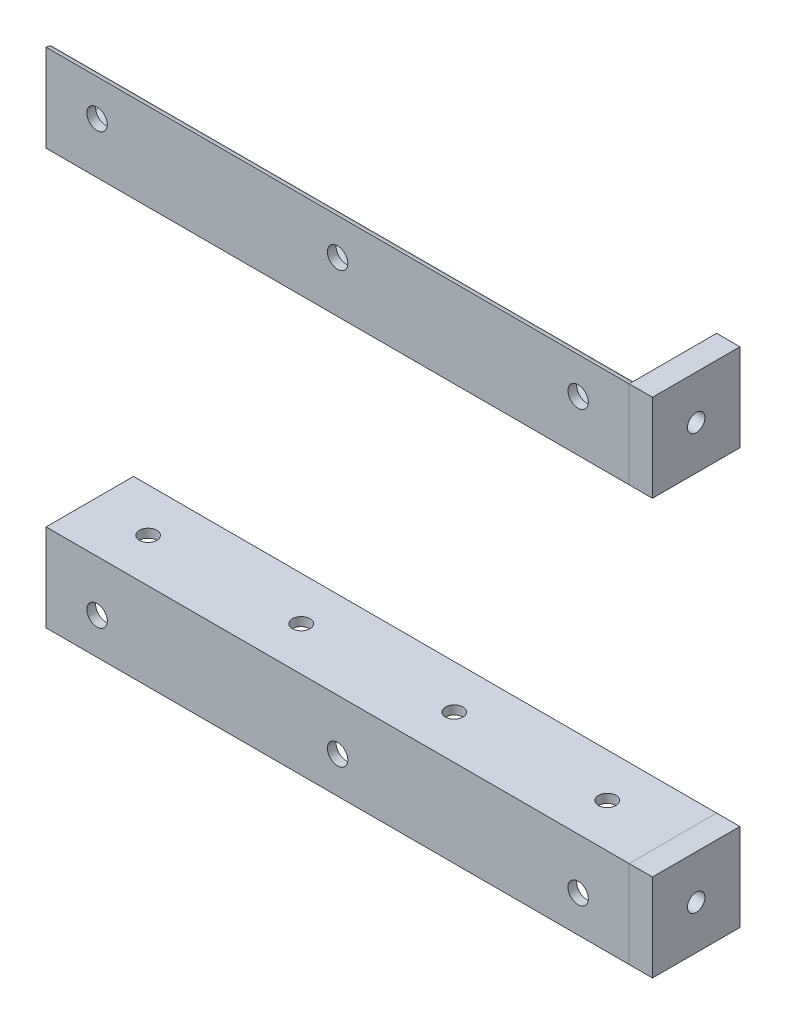
from build123d import *

# Parameters (mm, degrees)
GBT_706_2008_60_60_6_1_DEPTH     = 400
GBT_706_2008_60_60_6_2_DEPTH     = 400
GBT_706_2008_60_60_6_3_DEPTH     = 225
SKETCH_8_W                       = 60
SKETCH_8_H                       = 60
EXTRUDE_2_DEPTH                  = 16
EXTRUDE_2_2_DEPTH                = 16
HOLE_WIZARD_M14_2_AT_2_COUNT     = 2
HOLE_WIZARD_M14_2_AT_2_PITCH     = 285
SKETCH_12_W                      = 6
SKETCH_12_H                      = 291
HOLE_WIZARD_12_0_12_1_AT_2_COUNT = 2
HOLE_WIZARD_12_0_12_1_AT_2_PITCH = 105
HOLE_WIZARD_12_0_12_1_AT_3_COUNT = 2
HOLE_WIZARD_12_0_12_1_AT_3_PITCH = 210
HOLE_WIZARD_12_0_12_1_AT_4_COUNT = 2
HOLE_WIZARD_12_0_12_1_AT_4_PITCH = 315
SKETCH_14_W                      = 7
SKETCH_14_H                      = 6
HOLE_WIZARD_14_0_14_1_AT_2_COUNT = 2
HOLE_WIZARD_14_0_14_1_AT_2_PITCH = 165
HOLE_WIZARD_14_0_14_1_AT_3_COUNT = 2
HOLE_WIZARD_14_0_14_1_AT_3_PITCH = 330
HOLE_WIZARD_14_0_14_1_AT_4_COUNT = 2
HOLE_WIZARD_14_0_14_1_AT_4_PITCH = 295
HOLE_WIZARD_14_0_14_1_AT_5_COUNT = 2
HOLE_WIZARD_14_0_14_1_AT_5_PITCH = 338.008875623
HOLE_WIZARD_14_0_14_1_AT_6_COUNT = 2
HOLE_WIZARD_14_0_14_1_AT_6_PITCH = 442.634160453
HOLE_WIZARD_14_0_14_1_AT_7_COUNT = 2
HOLE_WIZARD_14_0_14_1_AT_7_PITCH = 406.970514902
HOLE_WIZARD_14_0_14_1_AT_8_COUNT = 2
HOLE_WIZARD_14_0_14_1_AT_8_PITCH = 456.508488421
SKETCH_15_W                      = 60
SKETCH_15_H                      = 225
CUT_EXTRUDE_1_DEPTH              = 100


with BuildPart() as part:
    # Sketch13 → Gbt 706-2008 热轧型钢_等边角钢 60×60×6(1) (new body)
    with BuildSketch(Plane(origin=(0, 225, 0), x_dir=(0, 0, -1), z_dir=(1, 0, 0))):
        with BuildLine():
            Line((0, 60), (0, 0))
            Line((0, 0), (60, 0))
            ThreePointArc((60, 0), (58.242640687, 4.242640687), (54, 6))
            Line((54, 6), (12.5, 6))
            ThreePointArc((12.5, 6), (7.903805922, 7.903805922), (6, 12.5))
            Line((6, 12.5), (6, 54))
            ThreePointArc((6, 54), (4.242640687, 58.242640687), (0, 60))
        make_face()
    extrude(amount=GBT_706_2008_60_60_6_1_DEPTH)


with BuildPart() as body_2:
    # Sketch1 → Gbt 706-2008 热轧型钢_等边角钢 60×60×6(2) (new body)
    with BuildSketch(Plane(origin=(0, 0, 0), x_dir=(0, -1, 0), z_dir=(1, 0, 0))):
        with BuildLine():
            Line((0, 60), (0, 0))
            Line((0, 0), (60, 0))
            ThreePointArc((60, 0), (58.242640687, 4.242640687), (54, 6))
            Line((54, 6), (12.5, 6))
            ThreePointArc((12.5, 6), (7.903805922, 7.903805922), (6, 12.5))
            Line((6, 12.5), (6, 54))
            ThreePointArc((6, 54), (4.242640687, 58.242640687), (0, 60))
        make_face()
    extrude(amount=GBT_706_2008_60_60_6_2_DEPTH)


with BuildPart() as body_3:
    # Sketch14 → Gbt 706-2008 热轧型钢_等边角钢 60×60×6(3) (new body)
    with BuildSketch(Plane(origin=(0, 225, 0), x_dir=(-1, 0, 0), z_dir=(0, -1, 0))):
        with BuildLine():
            Line((0, 60), (0, 0))
            Line((0, 0), (60, 0))
            ThreePointArc((60, 0), (58.242640687, 4.242640687), (54, 6))
            Line((54, 6), (12.5, 6))
            ThreePointArc((12.5, 6), (7.903805922, 7.903805922), (6, 12.5))
            Line((6, 12.5), (6, 54))
            ThreePointArc((6, 54), (4.242640687, 58.242640687), (0, 60))
        make_face()
    extrude(amount=GBT_706_2008_60_60_6_3_DEPTH)


with BuildPart() as body_4:
    # 草图8 → 凸台-拉伸2 (new body)
    with BuildSketch(Plane(origin=(400, 0, 0), x_dir=(0, 0, -1), z_dir=(1, 0, 0))):
        with Locations((30, 255)):
            Rectangle(SKETCH_8_W, SKETCH_8_H)
    extrude(amount=EXTRUDE_2_DEPTH)

    # 草图10 → M14 螺纹孔2 (revolve, cut)
    with BuildSketch(Plane(origin=(416, 255, -30), x_dir=(0, 0, -1), z_dir=(0, 1, 0))):
        Polygon((0, 0), (0, 41.605163714), (6, 38), (6, 0), align=None)
    hole_wizard_m14_2 = revolve(axis=Axis((422.35, 255, -30), (-1, 0, 0)), mode=Mode.SUBTRACT)


with BuildPart() as body_5:
    # 草图8 → Extrude 2 2 (new body)
    with BuildSketch(Plane(origin=(400, 0, 0), x_dir=(0, 0, -1), z_dir=(1, 0, 0))):
        with Locations((30, -30)):
            Rectangle(SKETCH_8_W, SKETCH_8_H)
    extrude(amount=EXTRUDE_2_2_DEPTH)

    # M14 螺纹孔2 at 2: M14 螺纹孔2 ×2
    with Locations(*[(0, -i * HOLE_WIZARD_M14_2_AT_2_PITCH, 0) for i in range(1, HOLE_WIZARD_M14_2_AT_2_COUNT)]):
        add(hole_wizard_m14_2, mode=Mode.SUBTRACT)


with BuildPart() as hole_wizard_12_0_12_1_tool:
    # 草图12 → Ø12.0 (12) 直径孔1 (revolve)
    with BuildSketch(Plane(origin=(355, -6, -30), x_dir=(0, 0, -1), z_dir=(1, 0, 0))):
        with Locations((3, 145.5)):
            Rectangle(SKETCH_12_W, SKETCH_12_H)
    hole_wizard_12_0_12_1 = revolve(axis=Axis((355, -12.35, -30), (0, 1, 0)))


with BuildPart() as part_1:
    add(part.part)

    # Ø12.0 (12) 直径孔1: cut by hole_wizard_12_0_12_1_tool
    add(hole_wizard_12_0_12_1_tool.part, mode=Mode.SUBTRACT)


with BuildPart() as body_2_1:
    add(body_2.part)

    # Ø12.0 (12) 直径孔1: cut by hole_wizard_12_0_12_1_tool
    add(hole_wizard_12_0_12_1_tool.part, mode=Mode.SUBTRACT)


with BuildPart() as hole_wizard_12_0_12_1_at_2_tool:
    # Ø12.0 (12) 直径孔1 at 2: Ø12.0 (12) 直径孔1 ×2
    with Locations(*[(-i * HOLE_WIZARD_12_0_12_1_AT_2_PITCH, 0, 0) for i in range(1, HOLE_WIZARD_12_0_12_1_AT_2_COUNT)]):
        add(hole_wizard_12_0_12_1)


with BuildPart() as part_2:
    add(part_1.part)

    # Ø12.0 (12) 直径孔1 at 2: cut by hole_wizard_12_0_12_1_at_2_tool
    add(hole_wizard_12_0_12_1_at_2_tool.part, mode=Mode.SUBTRACT)


with BuildPart() as body_2_2:
    add(body_2_1.part)

    # Ø12.0 (12) 直径孔1 at 2: cut by hole_wizard_12_0_12_1_at_2_tool
    add(hole_wizard_12_0_12_1_at_2_tool.part, mode=Mode.SUBTRACT)


with BuildPart() as hole_wizard_12_0_12_1_at_3_tool:
    # Ø12.0 (12) 直径孔1 at 3: Ø12.0 (12) 直径孔1 ×2
    with Locations(*[(-i * HOLE_WIZARD_12_0_12_1_AT_3_PITCH, 0, 0) for i in range(1, HOLE_WIZARD_12_0_12_1_AT_3_COUNT)]):
        add(hole_wizard_12_0_12_1)


with BuildPart() as part_3:
    add(part_2.part)

    # Ø12.0 (12) 直径孔1 at 3: cut by hole_wizard_12_0_12_1_at_3_tool
    add(hole_wizard_12_0_12_1_at_3_tool.part, mode=Mode.SUBTRACT)


with BuildPart() as body_2_3:
    add(body_2_2.part)

    # Ø12.0 (12) 直径孔1 at 3: cut by hole_wizard_12_0_12_1_at_3_tool
    add(hole_wizard_12_0_12_1_at_3_tool.part, mode=Mode.SUBTRACT)


with BuildPart() as hole_wizard_12_0_12_1_at_4_tool:
    # Ø12.0 (12) 直径孔1 at 4: Ø12.0 (12) 直径孔1 ×2
    with Locations(*[(-i * HOLE_WIZARD_12_0_12_1_AT_4_PITCH, 0, 0) for i in range(1, HOLE_WIZARD_12_0_12_1_AT_4_COUNT)]):
        add(hole_wizard_12_0_12_1)


with BuildPart() as part_4:
    add(part_3.part)

    # Ø12.0 (12) 直径孔1 at 4: cut by hole_wizard_12_0_12_1_at_4_tool
    add(hole_wizard_12_0_12_1_at_4_tool.part, mode=Mode.SUBTRACT)

    # 草图14 → Ø14.0 (14) 直径孔1 (revolve, cut)
    with BuildSketch(Plane(origin=(365, 260, -6), x_dir=(0, 1, 0), z_dir=(1, 0, 0))):
        with Locations((3.5, 3)):
            Rectangle(SKETCH_14_W, SKETCH_14_H)
    hole_wizard_14_0_14_1 = revolve(axis=Axis((365, 260, -12.35), (0, 0, 1)), mode=Mode.SUBTRACT)

    # Ø14.0 (14) 直径孔1 at 2: Ø14.0 (14) 直径孔1 ×2
    with Locations(*[(-i * HOLE_WIZARD_14_0_14_1_AT_2_PITCH, 0, 0) for i in range(1, HOLE_WIZARD_14_0_14_1_AT_2_COUNT)]):
        add(hole_wizard_14_0_14_1, mode=Mode.SUBTRACT)

    # Ø14.0 (14) 直径孔1 at 3: Ø14.0 (14) 直径孔1 ×2
    with Locations(*[(-i * HOLE_WIZARD_14_0_14_1_AT_3_PITCH, 0, 0) for i in range(1, HOLE_WIZARD_14_0_14_1_AT_3_COUNT)]):
        add(hole_wizard_14_0_14_1, mode=Mode.SUBTRACT)


with BuildPart() as body_2_4:
    add(body_2_3.part)

    # Ø12.0 (12) 直径孔1 at 4: cut by hole_wizard_12_0_12_1_at_4_tool
    add(hole_wizard_12_0_12_1_at_4_tool.part, mode=Mode.SUBTRACT)

    # Ø14.0 (14) 直径孔1 at 4: Ø14.0 (14) 直径孔1 ×2
    with Locations(*[(0, -i * HOLE_WIZARD_14_0_14_1_AT_4_PITCH, 0) for i in range(1, HOLE_WIZARD_14_0_14_1_AT_4_COUNT)]):
        add(hole_wizard_14_0_14_1, mode=Mode.SUBTRACT)

    # Ø14.0 (14) 直径孔1 at 5: Ø14.0 (14) 直径孔1 ×2
    with Locations(*[Vector(-0.48815286195022645, -0.8727581471231325, 0) * (i * HOLE_WIZARD_14_0_14_1_AT_5_PITCH) for i in range(1, HOLE_WIZARD_14_0_14_1_AT_5_COUNT)]):
        add(hole_wizard_14_0_14_1, mode=Mode.SUBTRACT)

    # Ø14.0 (14) 直径孔1 at 6: Ø14.0 (14) 直径孔1 ×2
    with Locations(*[Vector(-0.7455366744903166, -0.6664646029534651, 0) * (i * HOLE_WIZARD_14_0_14_1_AT_6_PITCH) for i in range(1, HOLE_WIZARD_14_0_14_1_AT_6_COUNT)]):
        add(hole_wizard_14_0_14_1, mode=Mode.SUBTRACT)


with BuildPart() as body_3_1:
    add(body_3.part)

    # Ø14.0 (14) 直径孔1 at 7: Ø14.0 (14) 直径孔1 ×2
    with Locations(*[Vector(-0.9828721869343219, -0.1842885350501855, 0) * (i * HOLE_WIZARD_14_0_14_1_AT_7_PITCH) for i in range(1, HOLE_WIZARD_14_0_14_1_AT_7_COUNT)]):
        add(hole_wizard_14_0_14_1, mode=Mode.SUBTRACT)

    # Ø14.0 (14) 直径孔1 at 8: Ø14.0 (14) 直径孔1 ×2
    with Locations(*[Vector(-0.876215908676647, -0.48191874977215593, 0) * (i * HOLE_WIZARD_14_0_14_1_AT_8_PITCH) for i in range(1, HOLE_WIZARD_14_0_14_1_AT_8_COUNT)]):
        add(hole_wizard_14_0_14_1, mode=Mode.SUBTRACT)

    # 草图15 → 切除-拉伸1 (cut)
    with BuildSketch(Plane(origin=(0, 0, 0), x_dir=(0, 0, -1), z_dir=(1, 0, 0))):
        with Locations((30, 112.5)):
            Rectangle(SKETCH_15_W, SKETCH_15_H)
    extrude(amount=-CUT_EXTRUDE_1_DEPTH, mode=Mode.SUBTRACT)


solid = Compound([body_4.part, body_5.part, part_4.part, body_2_4.part])
